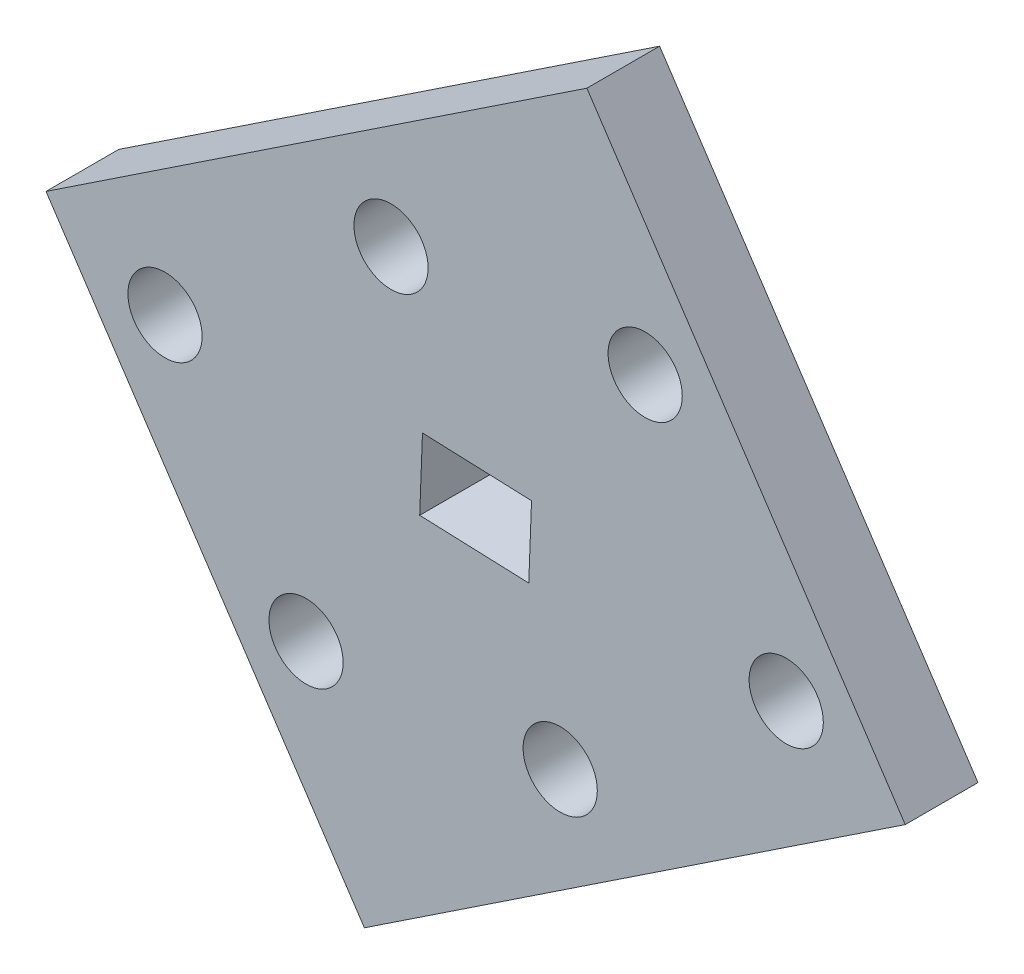
from build123d import *

# Parameters (mm, degrees)
SKETCH1_R           = 5.1
BOSS_EXTRUDE1_DEPTH = 10
CUT_EXTRUDE1_REACH  = 111.4


with BuildPart() as part:
    # Sketch1 → Boss-Extrude1 (new body)
    with BuildSketch(Plane.XY):
        Polygon((-3.661981052, -82.908158574), (70.673174696, -33.455495228), (26.915653686, 32.318962998), (-47.419502062, -17.133700347), align=None)
        Circle(SKETCH1_R, mode=Mode.SUBTRACT)
        with Locations((34.929606693, 2.218687963)):
            Circle(SKETCH1_R, mode=Mode.SUBTRACT)
        with Locations((54.315850178, -26.921894796)):
            Circle(SKETCH1_R, mode=Mode.SUBTRACT)
        with Locations((23.253672634, -50.589195576)):
            Circle(SKETCH1_R, mode=Mode.SUBTRACT)
        with Locations((-11.675934059, -52.807883539)):
            Circle(SKETCH1_R, mode=Mode.SUBTRACT)
        with Locations((-31.062177544, -23.66730078)):
            Circle(SKETCH1_R, mode=Mode.SUBTRACT)
    extrude(amount=-BOSS_EXTRUDE1_DEPTH)

    # Sketch2 → Cut-Extrude1 (cut, up to next)
    with BuildSketch(Plane.XY, mode=Mode.PRIVATE) as cut_extrude1_sk1:
        Polygon((4.322740293, -20.01253557), (19.311853758, -20.583917696), (18.930932341, -30.576660006), (3.941818876, -30.00527788), align=None)
    cut_extrude1_tool1 = extrude(cut_extrude1_sk1.sketch, amount=-CUT_EXTRUDE1_REACH, mode=Mode.PRIVATE) & part.part
    add(cut_extrude1_tool1.solids().sort_by_distance((11.626836, -25.294598, 0))[0], mode=Mode.SUBTRACT)


solid = part.part
